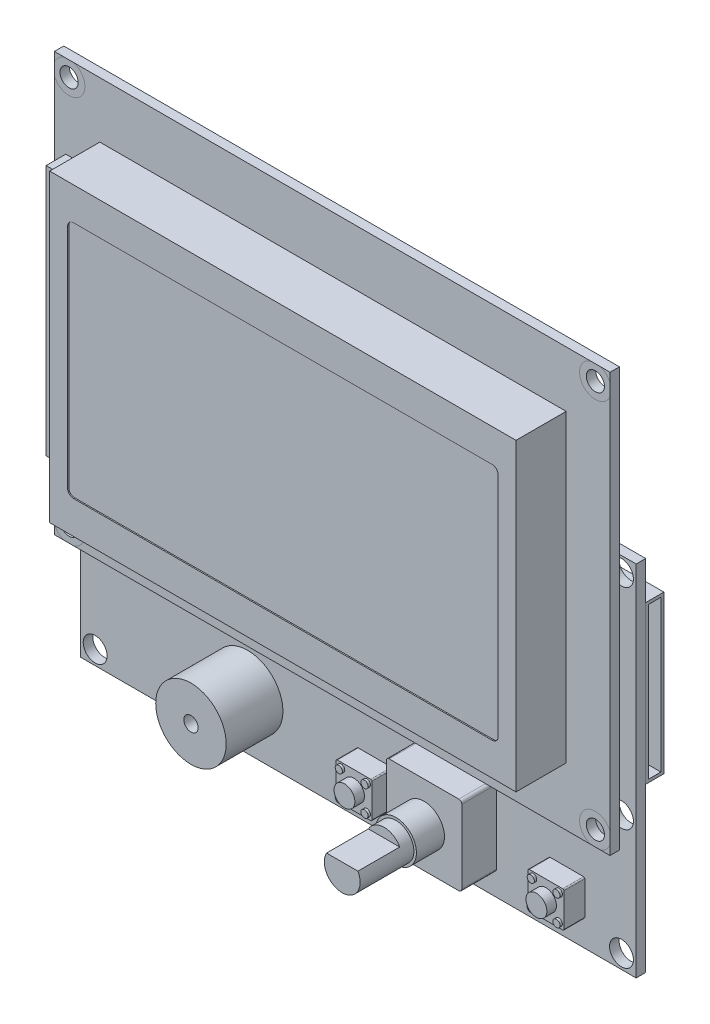
from build123d import *
from build123d.topology import SkipClean

# Parameters (mm, degrees)
SKETCH1_W            = 93.06
SKETCH1_H            = 70.1
SKETCH1_R            = 1.525
BOSS_EXTRUDE1_DEPTH  = 1.57
SKETCH2_W            = 78.1
SKETCH2_H            = 51
BOSS_EXTRUDE2_DEPTH  = 8.4
CUT_EXTRUDE1_DEPTH   = 0.2
SKETCH4_W            = 5.7
SKETCH4_H            = 42.1
BOSS_EXTRUDE3_DEPTH  = 3.3
SKETCH6_W            = 93.06
SKETCH6_H            = 60.05
BOSS_EXTRUDE4_DEPTH  = 1.6
SKETCH7_R            = 2
CUT_EXTRUDE2_DEPTH   = 1.6
BOSS_EXTRUDE5_REACH  = 118.934
SKETCH8_W            = 73.06
SKETCH8_H            = 2
SKETCH9_W            = 20.3
SKETCH9_H            = 8.75
SKETCH9_W_2          = 19.3
SKETCH9_H_2          = 7.75
BOSS_EXTRUDE6_DEPTH  = 9
BOSS_EXTRUDE7_DEPTH  = 3.05
CUT_EXTRUDE3_REACH   = 119.276
SKETCH11_W           = 2.05
SKETCH11_H           = 25.35
BOSS_EXTRUDE8_DEPTH  = 3.05
BOSS_EXTRUDE9_DEPTH  = 3.5
SKETCH15_R           = 1.75
BOSS_EXTRUDE10_DEPTH = 1.6
BOSS_EXTRUDE11_DEPTH = 5.8
SKETCH17_R           = 3.425
BOSS_EXTRUDE12_DEPTH = 4.7
BOSS_EXTRUDE13_DEPTH = 9
SKETCH19_R           = 0.6
BOSS_EXTRUDE14_DEPTH = 0.4
SKETCH21_R           = 5.9
BOSS_EXTRUDE15_DEPTH = 9.5
SKETCH22_R           = 1.2
CUT_EXTRUDE4_DEPTH   = 2
SKETCH23_R           = 3
BOSS_EXTRUDE16_DEPTH = 2


with BuildPart() as part:
    # Sketch1 → Boss-Extrude1 (new body)
    with BuildSketch(Plane.XY):
        with Locations((46.53, 35.05)):
            Rectangle(SKETCH1_W, SKETCH1_H)
        with Locations((2.455, 67.565)):
            Circle(SKETCH1_R, mode=Mode.SUBTRACT)
        with Locations((90.605, 67.565)):
            Circle(SKETCH1_R, mode=Mode.SUBTRACT)
        with Locations((90.605, 2.535)):
            Circle(SKETCH1_R, mode=Mode.SUBTRACT)
        with Locations((2.455, 2.535)):
            Circle(SKETCH1_R, mode=Mode.SUBTRACT)
    extrude(amount=BOSS_EXTRUDE1_DEPTH)

    # Sketch2 → Boss-Extrude2 (add)
    with BuildSketch(Plane.XY.offset(1.57)):
        with Locations((46.66, 35.25)):
            Rectangle(SKETCH2_W, SKETCH2_H)
    extrude(amount=BOSS_EXTRUDE2_DEPTH)

    # Sketch3 → Cut-Extrude1 (cut)
    with BuildSketch(Plane.XY.offset(9.97)):
        with BuildLine():
            Line((11.61, 55.25), (81.71, 55.25))
            ThreePointArc((81.71, 55.25), (82.417106781, 54.957106781), (82.71, 54.25))
            Line((82.71, 54.25), (82.71, 16.25))
            ThreePointArc((82.71, 16.25), (82.417106781, 15.542893219), (81.71, 15.25))
            Line((81.71, 15.25), (11.61, 15.25))
            ThreePointArc((11.61, 15.25), (10.902893219, 15.542893219), (10.61, 16.25))
            Line((10.61, 16.25), (10.61, 54.25))
            ThreePointArc((10.61, 54.25), (10.902893219, 54.957106781), (11.61, 55.25))
        make_face()
    extrude(amount=-CUT_EXTRUDE1_DEPTH, mode=Mode.SUBTRACT)

    # Sketch4 → Boss-Extrude3 (add)
    with BuildSketch(Plane.XY.offset(1.57)):
        with Locations((4.76, 35.1)):
            Rectangle(SKETCH4_W, SKETCH4_H)
    extrude(amount=BOSS_EXTRUDE3_DEPTH)


with BuildPart() as body_2:
    # Sketch6 → Boss-Extrude4 (new body)
    with BuildSketch(Plane(origin=(0, 0, -2.8), x_dir=(-1, 0, 0), z_dir=(0, 0, -1))):
        with Locations((-46.53, 10.075)):
            Rectangle(SKETCH6_W, SKETCH6_H)
    extrude(amount=BOSS_EXTRUDE4_DEPTH)

    # Sketch7 → Cut-Extrude2 (cut)
    with BuildSketch(Plane(origin=(0, 0, -4.4), x_dir=(-1, 0, 0), z_dir=(0, 0, -1))):
        with Locations((-90.605, 37.685)):
            Circle(SKETCH7_R)
        with Locations((-90.605, -17.565)):
            Circle(SKETCH7_R)
        with Locations((-2.455, -17.565)):
            Circle(SKETCH7_R)
        with Locations((-2.455, 37.685)):
            Circle(SKETCH7_R)
        with Locations((-90.605, 2.535)):
            Circle(SKETCH7_R)
        with Locations((-2.455, 2.535)):
            Circle(SKETCH7_R)
    extrude(amount=-CUT_EXTRUDE2_DEPTH, mode=Mode.SUBTRACT)

    # Sketch8 → Boss-Extrude5 (add, up to next)
    with BuildSketch(Plane(origin=(0, 0, 0), x_dir=(-1, 0, 0), z_dir=(0, 0, -1)), mode=Mode.PRIVATE) as boss_extrude5_sk1:
        with Locations((-46.53, 11)):
            Rectangle(SKETCH8_W, SKETCH8_H)
    boss_extrude5_tool1 = extrude(boss_extrude5_sk1.sketch, amount=BOSS_EXTRUDE5_REACH, mode=Mode.PRIVATE) - body_2.part
    # Sketch8 → Boss-Extrude5 (add, up to next)
    with BuildSketch(Plane(origin=(0, 0, 0), x_dir=(-1, 0, 0), z_dir=(0, 0, -1)), mode=Mode.PRIVATE) as boss_extrude5_sk2:
        with Locations((-46.53, 29.1)):
            Rectangle(SKETCH8_W, SKETCH8_H)
    boss_extrude5_tool2 = extrude(boss_extrude5_sk2.sketch, amount=BOSS_EXTRUDE5_REACH, mode=Mode.PRIVATE) - body_2.part

    add(part.part)  # Boss-Extrude5 merges part
    add(boss_extrude5_tool1.solids().sort_by_distance((46.53, 11, 0))[0])
    add(boss_extrude5_tool2.solids().sort_by_distance((46.53, 29.1, 0))[0])

    # Sketch9 → Boss-Extrude6 (add)
    # profile 1 of 2: a face of its own
    with BuildSketch(Plane(origin=(0, 0, -4.4), x_dir=(-1, 0, 0), z_dir=(0, 0, -1))):
        with Locations((-37.65, 34.075)):
            Rectangle(SKETCH9_W, SKETCH9_H)
        with Locations((-37.65, 34.075)):
            Rectangle(SKETCH9_W_2, SKETCH9_H_2, mode=Mode.SUBTRACT)
    # profile 2 of 2: a face of its own
    with BuildSketch(Plane(origin=(0, 0, -4.4), x_dir=(-1, 0, 0), z_dir=(0, 0, -1))):
        with Locations((-16.65, 34.075)):
            Rectangle(SKETCH9_W, SKETCH9_H)
        with Locations((-16.65, 34.075)):
            Rectangle(SKETCH9_W_2, SKETCH9_H_2, mode=Mode.SUBTRACT)
    extrude(amount=BOSS_EXTRUDE6_DEPTH)

    # Sketch10 → Boss-Extrude7 (add)
    with BuildSketch(Plane(origin=(0, 0, -4.4), x_dir=(-1, 0, 0), z_dir=(0, 0, -1))):
        Polygon((-93.06, 33.7), (-66.46, 33.7), (-66.46, 9.35), (-71.86, 9.35), (-75.06, 7.35), (-93.06, 7.35), align=None)
    extrude(amount=BOSS_EXTRUDE7_DEPTH)

    # Sketch11 → Cut-Extrude3 (cut, up to next)
    with BuildSketch(Plane(origin=(93.06, 0, 0), x_dir=(0, 0, -1), z_dir=(1, 0, 0)), mode=Mode.PRIVATE) as cut_extrude3_sk1:
        with Locations((5.925, 20.525)):
            Rectangle(SKETCH11_W, SKETCH11_H)
    cut_extrude3_tool1 = extrude(cut_extrude3_sk1.sketch, amount=-CUT_EXTRUDE3_REACH, mode=Mode.PRIVATE) & body_2.part
    add(cut_extrude3_tool1.solids().sort_by_distance((93.06, 20.525, -5.925))[0], mode=Mode.SUBTRACT)

    # Sketch12 → Boss-Extrude8 (add)
    with BuildSketch(Plane(origin=(0, 0, -7.45), x_dir=(-1, 0, 0), z_dir=(0, 0, -1))):
        Polygon((-75.06, 7.35), (-71.86, 9.35), (-66.46, 9.35), (-66.46, 33.7), (-66.96, 33.7), (-66.96, 9.85), (-72.003398113, 9.85), (-75.203398113, 7.85), (-77.778406171, 7.85), (-77.778406171, 7.35), align=None)
    extrude(amount=-BOSS_EXTRUDE8_DEPTH)

    # Sketch14 → Boss-Extrude9 (add)
    with BuildSketch(Plane.XY.offset(-2.8)):
        with BuildLine():
            Line((78.66, -9.65), (84.26, -9.65))
            ThreePointArc((84.26, -9.65), (84.401421356, -9.708578644), (84.46, -9.85))
            Line((84.46, -9.85), (84.46, -15.45))
            ThreePointArc((84.46, -15.45), (84.401421356, -15.591421356), (84.26, -15.65))
            Line((84.26, -15.65), (78.66, -15.65))
            ThreePointArc((78.66, -15.65), (78.518578644, -15.591421356), (78.46, -15.45))
            Line((78.46, -15.45), (78.46, -9.85))
            ThreePointArc((78.46, -9.85), (78.518578644, -9.708578644), (78.66, -9.65))
        make_face()
        with BuildLine():
            Line((46.51, -9.85), (52.11, -9.85))
            ThreePointArc((52.11, -9.85), (52.251421356, -9.908578644), (52.31, -10.05))
            Line((52.31, -10.05), (52.31, -15.65))
            ThreePointArc((52.31, -15.65), (52.251421356, -15.791421356), (52.11, -15.85))
            Line((52.11, -15.85), (46.51, -15.85))
            ThreePointArc((46.51, -15.85), (46.368578644, -15.791421356), (46.31, -15.65))
            Line((46.31, -15.65), (46.31, -10.05))
            ThreePointArc((46.31, -10.05), (46.368578644, -9.908578644), (46.51, -9.85))
        make_face()
    extrude(amount=BOSS_EXTRUDE9_DEPTH)

    # Sketch15 → Boss-Extrude10 (add)
    with BuildSketch(Plane.XY.offset(0.7)):
        with Locations((49.31, -12.85)):
            Circle(SKETCH15_R)
        with Locations((81.46, -12.65)):
            Circle(SKETCH15_R)
    extrude(amount=BOSS_EXTRUDE10_DEPTH)

    # Sketch16 → Boss-Extrude11 (add)
    with BuildSketch(Plane.XY.offset(-2.8)):
        with BuildLine():
            Line((57.51, -3.05), (69.16, -3.05))
            ThreePointArc((69.16, -3.05), (69.513553391, -3.196446609), (69.66, -3.55))
            Line((69.66, -3.55), (69.66, -15.85))
            ThreePointArc((69.66, -15.85), (69.513553391, -16.203553391), (69.16, -16.35))
            Line((69.16, -16.35), (57.51, -16.35))
            ThreePointArc((57.51, -16.35), (57.156446609, -16.203553391), (57.01, -15.85))
            Line((57.01, -15.85), (57.01, -3.55))
            ThreePointArc((57.01, -3.55), (57.156446609, -3.196446609), (57.51, -3.05))
        make_face()
    extrude(amount=BOSS_EXTRUDE11_DEPTH)

    # Sketch17 → Boss-Extrude12 (add)
    with BuildSketch(Plane.XY.offset(3)):
        with Locations((63.335, -9.7)):
            Circle(SKETCH17_R)
    extrude(amount=BOSS_EXTRUDE12_DEPTH)

    # Sketch18 → Boss-Extrude13 (add)
    with BuildSketch(Plane.XY.offset(7.7)):
        with BuildLine():
            Line((60.708690803, -8.25), (65.961309197, -8.25))
            ThreePointArc((65.961309197, -8.25), (63.335, -12.7), (60.708690803, -8.25))
        make_face()
    extrude(amount=BOSS_EXTRUDE13_DEPTH)

    # Sketch19 → Boss-Extrude14 (add)
    with BuildSketch(Plane.XY.offset(0.7)):
        with Locations((79.31, -10.5)):
            Circle(SKETCH19_R)
        with Locations((83.61, -10.5)):
            Circle(SKETCH19_R)
        with Locations((83.61, -14.8)):
            Circle(SKETCH19_R)
        with Locations((79.31, -14.8)):
            Circle(SKETCH19_R)
        with Locations((47.16, -10.7)):
            Circle(SKETCH19_R)
        with Locations((51.46, -10.7)):
            Circle(SKETCH19_R)
        with Locations((51.46, -15)):
            Circle(SKETCH19_R)
        with Locations((47.16, -15)):
            Circle(SKETCH19_R)
    extrude(amount=BOSS_EXTRUDE14_DEPTH)

    # Sketch21 → Boss-Extrude15 (add)
    with BuildSketch(Plane.XY.offset(-2.8)):
        with Locations(Location((28, -10.85, 0), (0, 0, 180))):
            Circle(SKETCH21_R)
    extrude(amount=BOSS_EXTRUDE15_DEPTH)

    # Sketch22 → Cut-Extrude4 (cut)
    with BuildSketch(Plane.XY.offset(6.7)):
        with Locations((28, -10.85)):
            Circle(SKETCH22_R)
    extrude(amount=-CUT_EXTRUDE4_DEPTH, mode=Mode.SUBTRACT)

    # Sketch23 → Boss-Extrude16 (add)
    with SkipClean():  # the faces are left unmerged after this step: merging them gives an invalid solid
        with BuildSketch(Plane.XY.offset(7.7)):
            with Locations(Location((63.335, -9.7, 0), (0, 0, 151.09666546))):
                Circle(SKETCH23_R)
        extrude(amount=BOSS_EXTRUDE16_DEPTH)


solid = body_2.part
